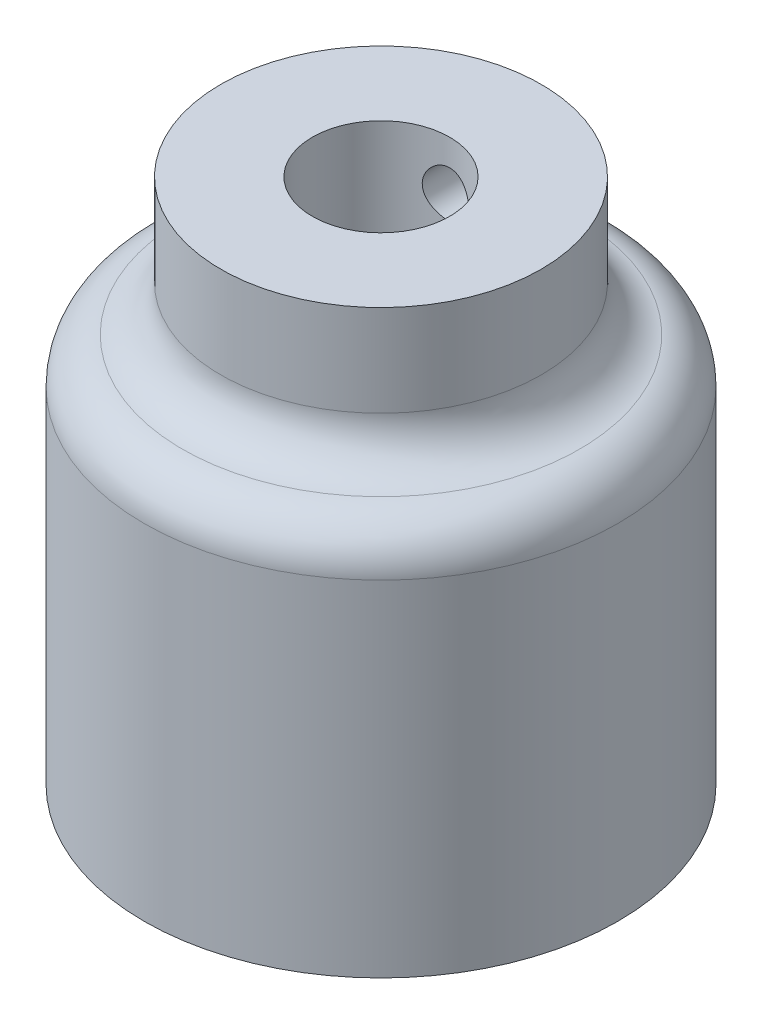
from build123d import *

# Parameters (mm, degrees)
FILLET1_R               = 1
FILLET2_R               = 1
BOSS_EXTRUDE1_DEPTH     = 7
CUT_EXTRUDE1_REACH      = 12.127
CUT_EXTRUDE1_END_RADIUS = 5.175
SKETCH2_R               = 1.51
SKETCH2_R_2             = 0.51
SKETCH4_R               = 0.75
CUT_EXTRUDE2_DEPTH      = 1.5


with BuildPart() as part:
    # Sketch1 → Revolve1 (revolve)
    with BuildSketch(Plane.XY, mode=Mode.PRIVATE) as revolve1_sk:
        Polygon((0, 0), (3.175, 0), (3.175, -7), (5.175, -7), (5.175, -4.640909091), (5.175, 1.5), (3.5, 1.5), (3.5, 4.5), (1.5, 4.5), (1.5, 1.5), (0, 1.5), align=None)
    revolve(revolve1_sk.sketch.rotate(Axis((0, 1.5, 0), (0, -1, 0)), 180), axis=Axis((0, 1.5, 0), (0, -1, 0)))

    # Fillet1
    fillet1_edges = [part.edges().sort_by_distance(p)[0] for p in [
        (3.5, 1.5, 0),
    ]]
    fillet(fillet1_edges, radius=FILLET1_R)

    # Fillet2
    fillet2_edges = [part.edges().sort_by_distance(p)[0] for p in [
        (5.175, 1.5, 0),
    ]]
    fillet(fillet2_edges, radius=FILLET2_R)

    # Sketch3 → Boss-Extrude1 (add)
    with BuildSketch(Plane.XZ.offset(7)):
        with BuildLine():
            Line((2.313006701, -2.175), (-2.313006701, -2.175))
            ThreePointArc((-2.313006701, -2.175), (0, -3.175), (2.313006701, -2.175))
        make_face()
    extrude(amount=-BOSS_EXTRUDE1_DEPTH)

    # Cut-Extrude1: up to this cylinder (the profile starts inside it)
    cut_extrude1_end = Plane(origin=(0, 0.120549, 0), z_dir=(0, 1, 0)) * Cylinder(CUT_EXTRUDE1_END_RADIUS, 42.18296, mode=Mode.PRIVATE)
    # Sketch2 → Cut-Extrude1 (cut, up to the surface)
    with BuildSketch(Plane.XY, mode=Mode.PRIVATE) as cut_extrude1_sk1:
        with Locations((0, -3.168930556)):
            Circle(SKETCH2_R)
    cut_extrude1_tool1 = extrude(cut_extrude1_sk1.sketch, amount=-CUT_EXTRUDE1_REACH, mode=Mode.PRIVATE) & cut_extrude1_end
    add(cut_extrude1_tool1.solids().sort_by_distance((0, -3.168931, 0))[0], mode=Mode.SUBTRACT)
    # Sketch2 → Cut-Extrude1 (cut, up to the surface)
    with BuildSketch(Plane.XY, mode=Mode.PRIVATE) as cut_extrude1_sk2:
        with Locations((0, 3.410029171)):
            Circle(SKETCH2_R_2)
    cut_extrude1_tool2 = extrude(cut_extrude1_sk2.sketch, amount=-CUT_EXTRUDE1_REACH, mode=Mode.PRIVATE) & cut_extrude1_end
    add(cut_extrude1_tool2.solids().sort_by_distance((0, 3.410029, 0))[0], mode=Mode.SUBTRACT)

    # Sketch4 → Cut-Extrude2 (cut)
    with BuildSketch(Plane.XZ):
        Circle(SKETCH4_R)
    extrude(amount=-CUT_EXTRUDE2_DEPTH, mode=Mode.SUBTRACT)


solid = part.part
